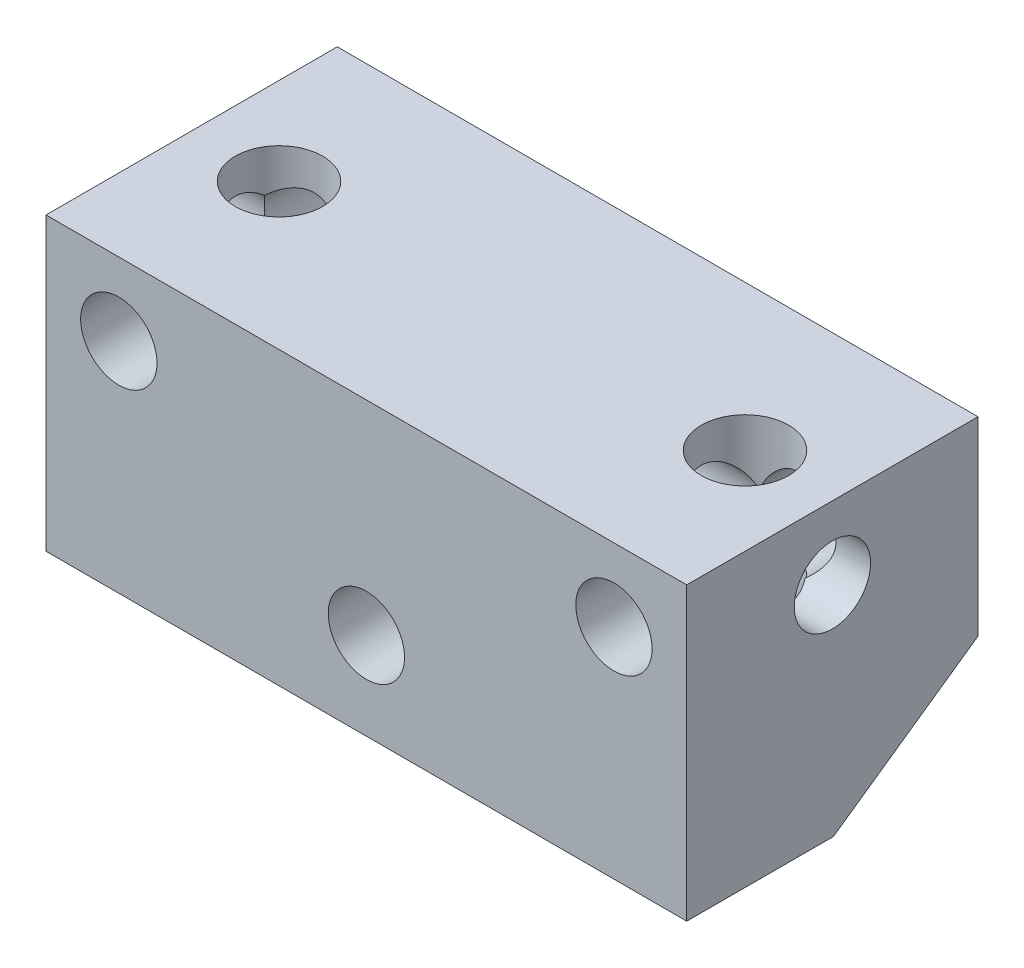
from build123d import *

# Parameters (mm, degrees)
BOSS_EXTRUDE1_DEPTH      = 22
SKETCH2_W                = 3.175
SKETCH2_H                = 7
SKETCH3_W                = 1.3105
SKETCH3_H                = 3.736370435
F_3_0_3_DIAMETER_HOLE1_D = 3
HOLE1_D                  = 2.621
HOLE1_DEPTH              = 23.719223594


with BuildPart() as part:
    # Sketch1 → Boss-Extrude1 (new body)
    with BuildSketch(Plane(origin=(11, 0, 0), x_dir=(0, 0, -1), z_dir=(1, 0, 0))):
        Polygon((-4.962592027, -10), (0, -6.525155654), (0, 0), (-10, 0), (-10, -10), align=None)
    extrude(amount=-BOSS_EXTRUDE1_DEPTH)

    # Sketch2 → Cut-Revolve1 (revolve, cut)
    with BuildSketch(Plane(origin=(0, -3.855908855, 5.506808545), x_dir=(1, 0, 0), z_dir=(0, -0.5735764363510462, 0.8191520442889919)), mode=Mode.PRIVATE) as cut_revolve1_sk:
        with Locations((1.5875, -1.845094593)):
            Rectangle(SKETCH2_W, SKETCH2_H)
    revolve(cut_revolve1_sk.sketch.rotate(Axis((0, -2.500289707, 6.456023291), (0, -0.8191520442889918, -0.5735764363510462)), 270), axis=Axis((0, -2.500289707, 6.456023291), (0, -0.8191520442889918, -0.5735764363510462)), mode=Mode.SUBTRACT)

    # Sketch3 → Cut-Revolve2 (revolve, cut)
    with BuildSketch(Plane(origin=(0, -7, 0), x_dir=(1, 0, 0), z_dir=(0, 1, 0))):
        with Locations((0.65525, -8.131814783)):
            Rectangle(SKETCH3_W, SKETCH3_H)
    revolve(axis=Axis((0, -7, 6.263629565), (0, 0, 1)), mode=Mode.SUBTRACT)

    # Sketch4 → Cut-Revolve3 (revolve, cut)
    with BuildSketch(Plane(origin=(0, -2.5, 0), x_dir=(1, 0, 0), z_dir=(0, 1, 0))):
        Polygon((-7.1895, 0), (-8.5, 0), (-8.5, -10), (-7.1895, -10), (-7.1895, -2), align=None)
    revolve(axis=Axis((-8.5, -2.5, 0), (0, 0, 1)), mode=Mode.SUBTRACT)

    # Sketch5 → Cut-Revolve4 (revolve, cut)
    with BuildSketch(Plane(origin=(0, -2.5, 0), x_dir=(1, 0, 0), z_dir=(0, 1, 0))):
        Polygon((9.8105, 0), (8.5, 0), (8.5, -10), (9.8105, -10), (9.8105, -2), align=None)
    revolve(axis=Axis((8.5, -2.5, 0), (0, 0, 1)), mode=Mode.SUBTRACT)

    # Ø3.0 (3) Diameter Hole1 (through all)
    with Locations(Plane(origin=(0, 0, 0), x_dir=(1, 0, 0), z_dir=(0, 1, 0))):
        with Locations((8, -5), (-8, -5)):
            Hole(F_3_0_3_DIAMETER_HOLE1_D / 2)

    # Hole1
    with Locations(Plane(origin=(11, 0, 0), x_dir=(0, 0, -1), z_dir=(1, 0, 0))):
        with Locations((-5, -2.5)):
            Hole(HOLE1_D / 2, depth=HOLE1_DEPTH)


solid = part.part
